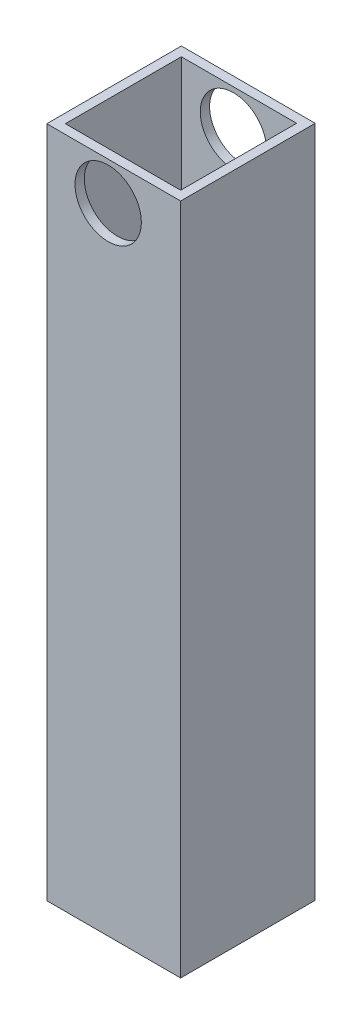
from build123d import *

# Parameters (mm, degrees)
SKETCH6_W           = 25.262112462
SKETCH6_H           = 25.4
BOSS_EXTRUDE3_DEPTH = 127
SKETCH8_R           = 6.263004549
CUT_EXTRUDE1_DEPTH  = 25.4
SKETCH9_W           = 21.756912462
SKETCH9_H           = 21.8948
CUT_EXTRUDE2_DEPTH  = 127


with BuildPart() as part:
    # Sketch6 → Boss-Extrude3 (new body)
    with BuildSketch(Plane(origin=(0, 0, 0), x_dir=(1, 0, 0), z_dir=(0, 1, 0))):
        with Locations((12.631056231, 12.7)):
            Rectangle(SKETCH6_W, SKETCH6_H)
    extrude(amount=BOSS_EXTRUDE3_DEPTH)

    # Sketch8 → Cut-Extrude1 (cut)
    with BuildSketch(Plane.XY):
        with Locations((11.587222139, 119.780054764)):
            Circle(SKETCH8_R)
    extrude(amount=-CUT_EXTRUDE1_DEPTH, mode=Mode.SUBTRACT)

    # Sketch9 → Cut-Extrude2 (cut)
    with BuildSketch(Plane(origin=(0, 0, 0), x_dir=(-1, 0, 0), z_dir=(0, -1, 0))):
        with Locations((-12.631056231, 12.7)):
            Rectangle(SKETCH9_W, SKETCH9_H)
    extrude(amount=-CUT_EXTRUDE2_DEPTH, mode=Mode.SUBTRACT)


solid = part.part
